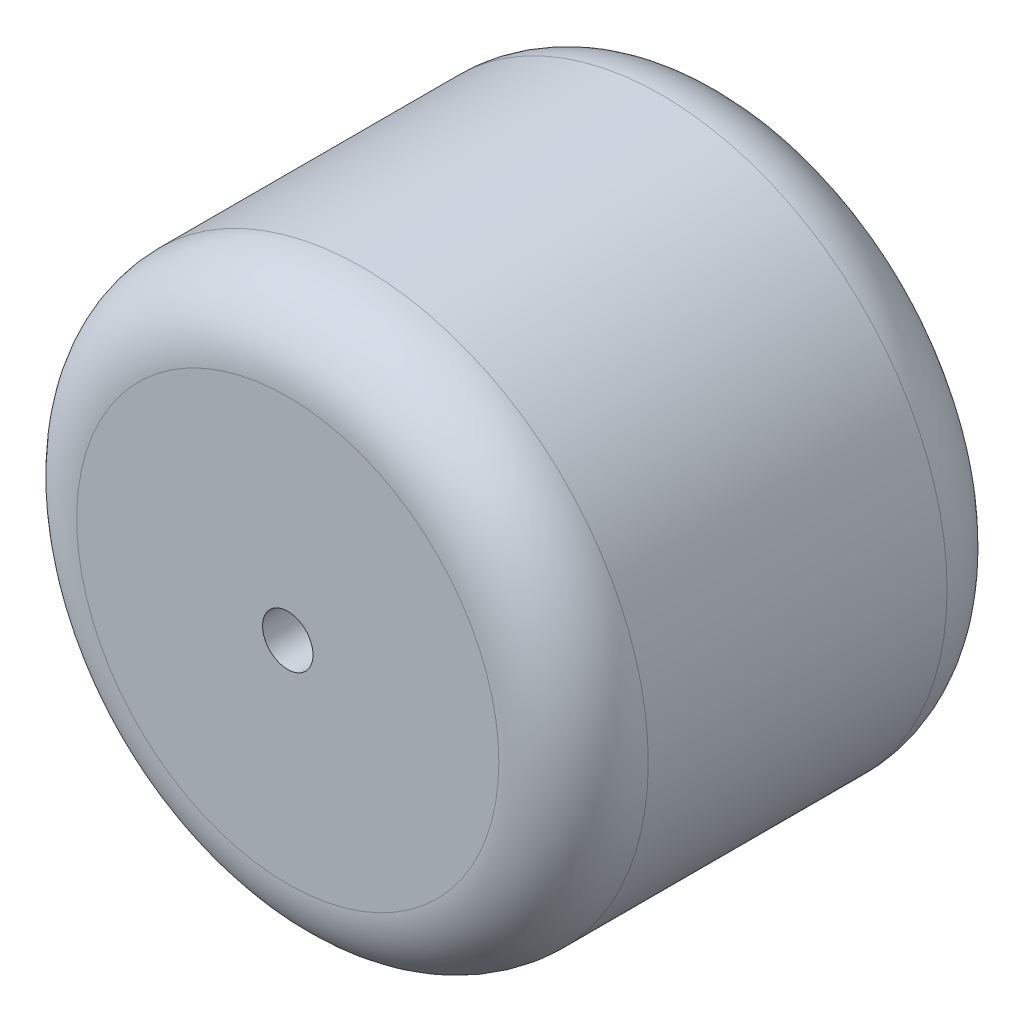
from build123d import *

# Parameters (mm, degrees)
SKETCH1_R           = 7.65
SKETCH1_R_2         = 0.675
BOSS_EXTRUDE1_DEPTH = 12
FILLET1_R           = 2


with BuildPart() as part:
    # Sketch1 → Boss-Extrude1 (new body)
    with BuildSketch(Plane.XY):
        Circle(SKETCH1_R)
        Circle(SKETCH1_R_2, mode=Mode.SUBTRACT)
    extrude(amount=BOSS_EXTRUDE1_DEPTH)

    # Fillet1
    fillet1_edges = [part.edges().sort_by_distance(p)[0] for p in [
        (-7.65, 0, 0),
        (-7.65, 0, 12),
    ]]
    fillet(fillet1_edges, radius=FILLET1_R)


solid = part.part
